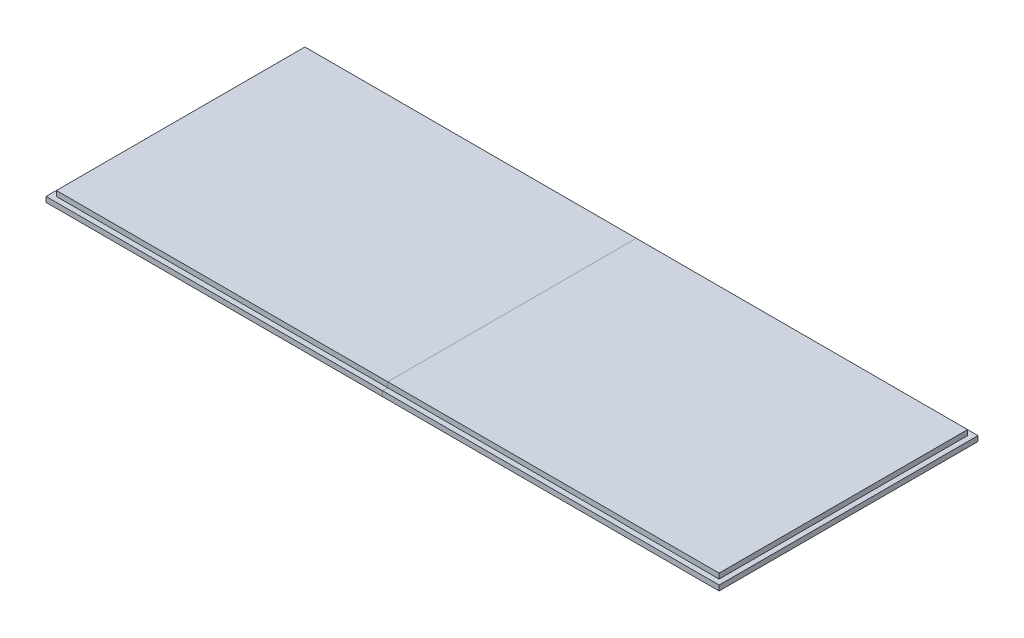
from build123d import *

# Parameters (mm, degrees)
SKETCH1_W           = 412.75
SKETCH1_H           = 158.75
SKETCH1_W_2         = 406.4
SKETCH1_H_2         = 152.4
BOSS_EXTRUDE3_DEPTH = 3.175
SKETCH2_W           = 406.4
SKETCH2_H           = 152.4
BOSS_EXTRUDE5_DEPTH = 6.35


with BuildPart() as part:
    # Sketch1 → Boss-Extrude3 (new body)
    with BuildSketch(Plane(origin=(0, 0, 0), x_dir=(1, 0, 0), z_dir=(0, 1, 0))):
        Rectangle(SKETCH1_W, SKETCH1_H)
        Rectangle(SKETCH1_W_2, SKETCH1_H_2, mode=Mode.SUBTRACT)
    extrude(amount=BOSS_EXTRUDE3_DEPTH)

    # Sketch2 → Boss-Extrude5 (add)
    with BuildSketch(Plane(origin=(0, 0, 0), x_dir=(1, 0, 0), z_dir=(0, 1, 0))):
        Rectangle(SKETCH2_W, SKETCH2_H)
    extrude(amount=BOSS_EXTRUDE5_DEPTH)


with BuildPart() as body_2:
    # Split1: the piece on the far side of the plane
    add(part.part)
    split(bisect_by=Plane.YZ, keep=Keep.BOTTOM)


with BuildPart() as part_1:
    add(part.part)

    # Split1
    split(bisect_by=Plane.YZ, keep=Keep.TOP)


solid = Compound([body_2.part, part_1.part])
